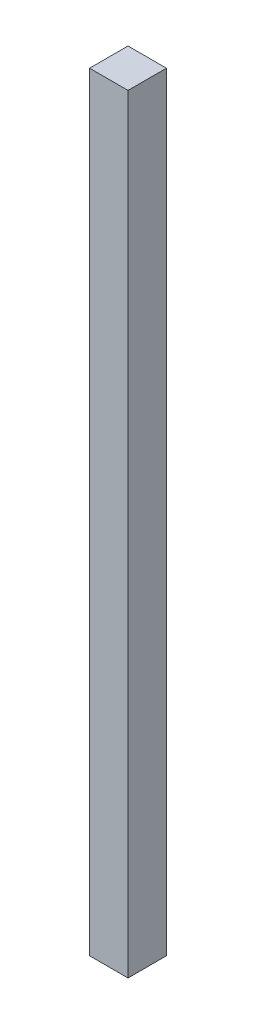
from build123d import *

# Parameters (mm, degrees)
SKETCH1_W           = 5
SKETCH1_H           = 5
BOSS_EXTRUDE1_DEPTH = 100


with BuildPart() as part:
    # Sketch1 → Boss-Extrude1 (new body)
    with BuildSketch(Plane(origin=(0, 0, 0), x_dir=(1, 0, 0), z_dir=(0, 1, 0))):
        Rectangle(SKETCH1_W, SKETCH1_H)
    extrude(amount=BOSS_EXTRUDE1_DEPTH)


solid = part.part
